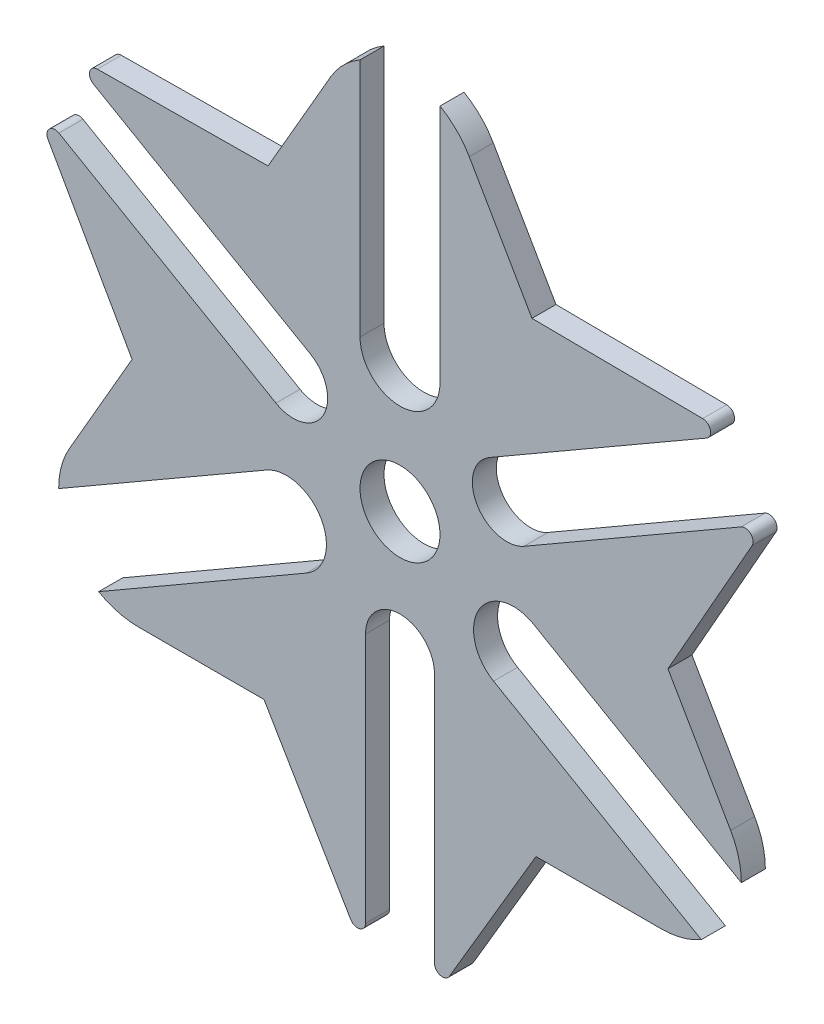
from build123d import *

# Parameters (mm, degrees)
SKETCH1_R           = 5
BOSS_EXTRUDE1_DEPTH = 3
FILLET1_R           = 1


with BuildPart() as part:
    # Sketch1 → Boss-Extrude1 (new body)
    with BuildSketch(Plane.XY):
        with BuildLine():
            Line((-5, 46.395280957), (-5, 16.395280957))
            ThreePointArc((-5, 16.395280957), (0, 11.395280957), (5, 16.395280957))
            Line((5, 16.395280957), (5, 46.395280957))
            ThreePointArc((5, 46.395280957), (7.071067812, 44.806094731), (8.660254038, 42.735026919))
            Line((8.660254038, 42.735026919), (16.5, 29.156188594))
            Line((16.5, 29.156188594), (41.509870079, 28.940674337))
            Line((41.509870079, 28.940674337), (11.198980946, 11.440674337))
            ThreePointArc((11.198980946, 11.440674337), (9.621988261, 5.555257513), (15.507405085, 3.978264828))
            Line((15.507405085, 3.978264828), (45.818294218, 21.478264828))
            Line((45.818294218, 21.478264828), (33.5, -0.288675135))
            Line((33.5, -0.288675135), (41.339745962, -13.867513459))
            ThreePointArc((41.339745962, -13.867513459), (42.338750187, -16.279323008), (42.679491924, -18.867513459))
            Line((42.679491924, -18.867513459), (16.698729811, -3.867513459))
            ThreePointArc((16.698729811, -3.867513459), (9.868602792, -5.697640478), (11.698729811, -12.527767497))
            Line((11.698729811, -12.527767497), (37.679491924, -27.527767497))
            ThreePointArc((37.679491924, -27.527767497), (35.267682375, -28.526771722), (32.679491924, -28.867513459))
            Line((32.679491924, -28.867513459), (17, -28.867513459))
            Line((17, -28.867513459), (4.308424139, -50.418939165))
            Line((4.308424139, -50.418939165), (4.308424139, -15.418939165))
            ThreePointArc((4.308424139, -15.418939165), (0, -11.110515025), (-4.308424139, -15.418939165))
            Line((-4.308424139, -15.418939165), (-4.308424139, -50.418939165))
            Line((-4.308424139, -50.418939165), (-17, -28.867513459))
            Line((-17, -28.867513459), (-32.679491924, -28.867513459))
            ThreePointArc((-32.679491924, -28.867513459), (-35.267682375, -28.526771722), (-37.679491924, -27.527767497))
            Line((-37.679491924, -27.527767497), (-11.698729811, -12.527767497))
            ThreePointArc((-11.698729811, -12.527767497), (-9.868602792, -5.697640478), (-16.698729811, -3.867513459))
            Line((-16.698729811, -3.867513459), (-42.679491924, -18.867513459))
            ThreePointArc((-42.679491924, -18.867513459), (-42.338750187, -16.279323008), (-41.339745962, -13.867513459))
            Line((-41.339745962, -13.867513459), (-33.5, -0.288675135))
            Line((-33.5, -0.288675135), (-45.818294218, 21.478264828))
            Line((-45.818294218, 21.478264828), (-15.507405085, 3.978264828))
            ThreePointArc((-15.507405085, 3.978264828), (-9.621988261, 5.555257513), (-11.198980946, 11.440674337))
            Line((-11.198980946, 11.440674337), (-41.509870079, 28.940674337))
            Line((-41.509870079, 28.940674337), (-16.5, 29.156188594))
            Line((-16.5, 29.156188594), (-8.660254038, 42.735026919))
            ThreePointArc((-8.660254038, 42.735026919), (-7.071067812, 44.806094731), (-5, 46.395280957))
        make_face()
        Circle(SKETCH1_R, mode=Mode.SUBTRACT)
    extrude(amount=BOSS_EXTRUDE1_DEPTH)

    # Fillet1
    fillet1_edges = [part.edges().sort_by_distance(p)[0] for p in [
        (41.509870079, 28.940674337, 1.5),
        (45.818294218, 21.478264828, 1.5),
        (4.308424139, -50.418939165, 1.5),
        (-4.308424139, -50.418939165, 1.5),
        (-45.818294218, 21.478264828, 1.5),
        (-41.509870079, 28.940674337, 1.5),
    ]]
    fillet(fillet1_edges, radius=FILLET1_R)


solid = part.part
